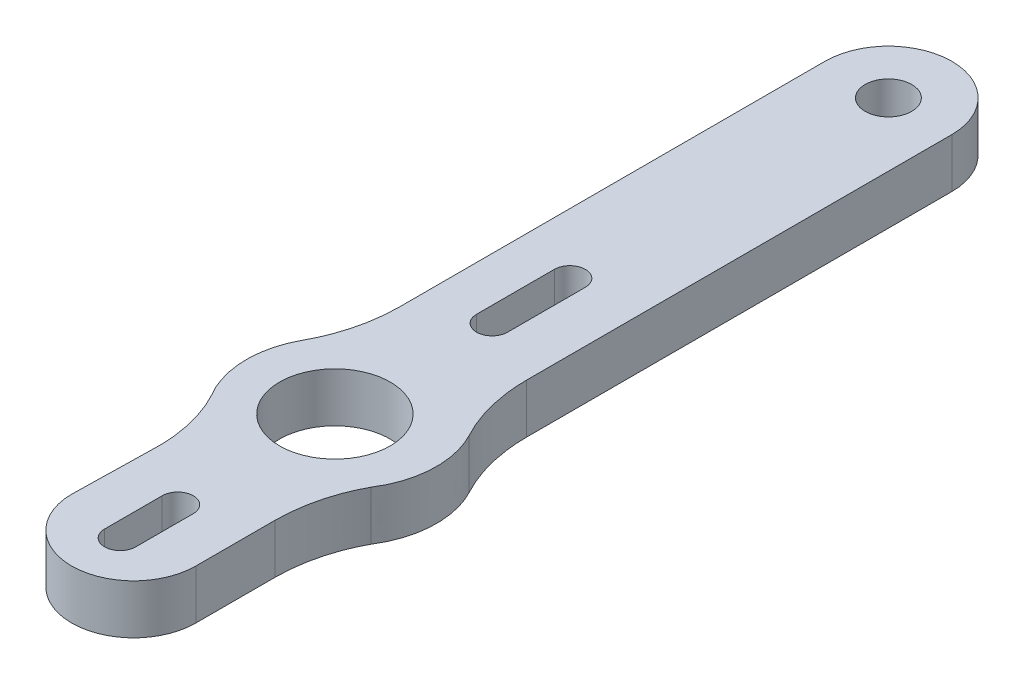
from build123d import *

# Parameters (mm, degrees)
SKETCH1_R           = 1.4986
SKETCH1_R_2         = 3.556
BOSS_EXTRUDE2_DEPTH = 3.175


with BuildPart() as part:
    # Sketch1 → Boss-Extrude2 (new body)
    with BuildSketch(Plane(origin=(0, 0, 0), x_dir=(1, 0, 0), z_dir=(0, 1, 0))):
        with BuildLine():
            Line((-3.88054086, 24.446655173), (-3.88054086, -2.874238183))
            add(Edge.make_bspline(
                [(-5.126415425, -7.816187942), (-4.308579975, -6.333908563), (-3.879875529, -4.567729194), (-3.88054086, -2.874238183)],
                knots=[2, 2, 2, 2, 3, 3, 3, 3], degree=3))
            add(Edge.make_bspline(
                [(-5.016324889, -13.818322138), (-6.095643591, -12.023073271), (-6.186493664, -9.73551085), (-5.126415425, -7.816187942)],
                knots=[1.005658807, 1.005658807, 1.005658807, 1.005658807, 2, 2, 2, 2], degree=3))
            add(Edge.make_bspline(
                [(-3.88054086, -18.316067774), (-3.88054086, -16.774680236), (-4.271386719, -15.167168465), (-5.016324889, -13.818322138)],
                knots=[17, 17, 17, 17, 18, 18, 18, 18], degree=3))
            Line((-3.88054086, -18.316067774), (-3.991875118, -23.843497505))
            ThreePointArc((-3.991875118, -23.843497505), (0.001069913, -27.836442536), (3.994014944, -23.843497505))
            Line((3.994014944, -23.843497505), (3.994014944, -18.759718562))
            add(Edge.make_bspline(
                [(5.241762742, -13.818322138), (4.423413244, -15.300216615), (3.994014944, -17.066290901), (3.994014944, -18.759718562)],
                knots=[11, 11, 11, 11, 12, 12, 12, 12], degree=3))
            add(Edge.make_bspline(
                [(5.522924723, -7.816187942), (6.529884526, -9.766435102), (6.373924923, -12.053304327), (5.241762742, -13.818322138)],
                knots=[9, 9, 9, 9, 10, 10, 10, 10], degree=3))
            add(Edge.make_bspline(
                [(4.275176926, -2.874728037), (4.275176926, -4.568219179), (4.704575226, -6.334229984), (5.522924723, -7.816187942)],
                knots=[8, 8, 8, 8, 9, 9, 9, 9], degree=3))
            Line((4.275176926, -2.874728037), (4.275176926, 24.479419578))
            ThreePointArc((4.275176926, 24.479419578), (0.180935831, 28.540896268), (-3.88054086, 24.446655173))
        make_face()
        with Locations(Location((0.197318033, 24.463037376, 0), (0, 0, 270))):
            Circle(SKETCH1_R, mode=Mode.SUBTRACT)
        with Locations(Location((0.001040667, -10.913296245, 0), (0, 0, 270))):
            Circle(SKETCH1_R_2, mode=Mode.SUBTRACT)
        with BuildLine():
            Line((0.999301297, -0.813017652), (0.999301297, 4.187201199))
            ThreePointArc((0.999301297, 4.187201199), (0.001069914, 5.185432583), (-0.99716147, 4.187201199))
            Line((-0.99716147, 4.187201199), (-0.99716147, -0.813017652))
            ThreePointArc((-0.99716147, -0.813017652), (0.001069914, -1.811249036), (0.999301297, -0.813017652))
        make_face(mode=Mode.SUBTRACT)
        with BuildLine():
            Line((0.999301296, -24.713674478), (0.999301296, -21.01357972))
            ThreePointArc((0.999301296, -21.01357972), (0.001069913, -20.015348337), (-0.997161471, -21.01357972))
            Line((-0.997161471, -21.01357972), (-0.997161471, -24.713674478))
            ThreePointArc((-0.997161471, -24.713674478), (0.001069913, -25.711905862), (0.999301296, -24.713674478))
        make_face(mode=Mode.SUBTRACT)
    extrude(amount=BOSS_EXTRUDE2_DEPTH)


solid = part.part
